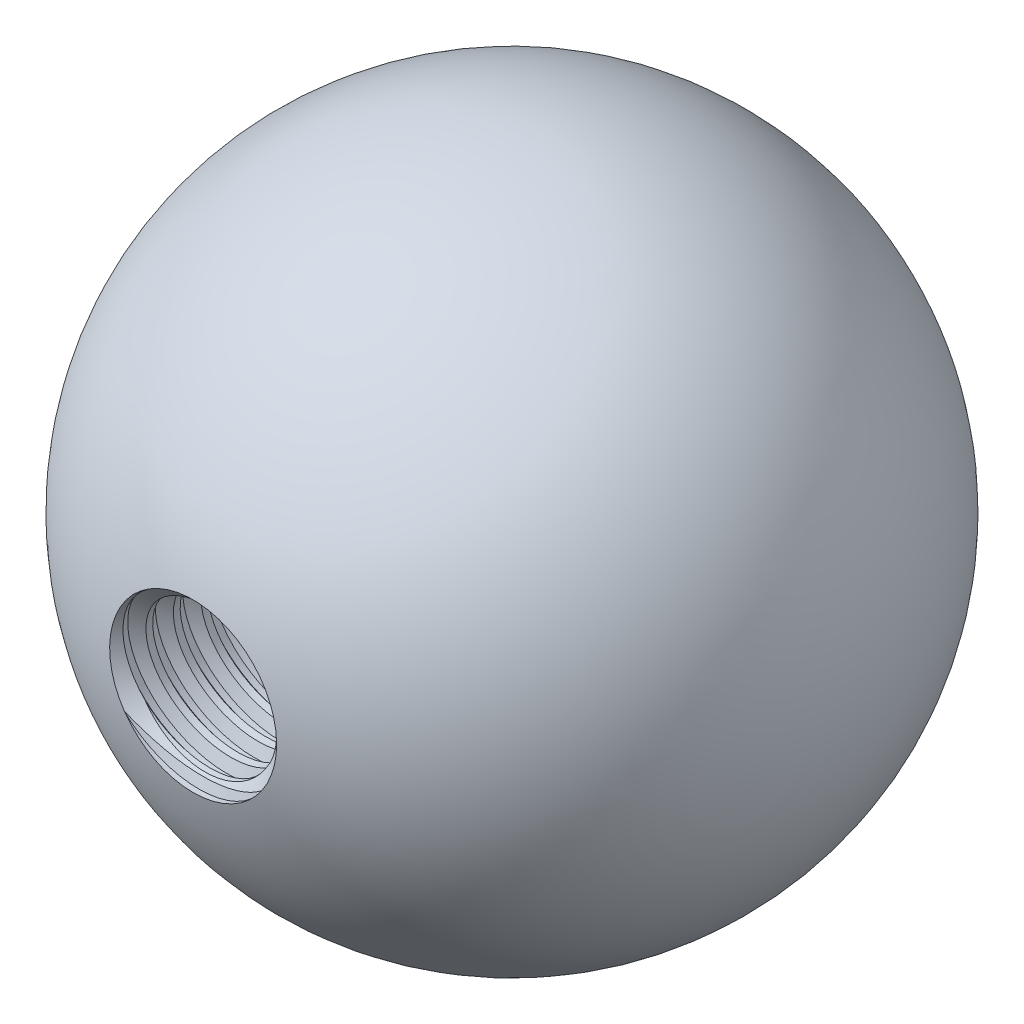
from build123d import *

# Parameters (mm, degrees)
SKETCH1_W           = 9.525
SKETCH1_H           = 2.413
LPATTERN1_COUNT     = 12
LPATTERN1_PITCH     = 0.79375
LPATTERN1_COL_COUNT = 2
LPATTERN1_COL_PITCH = 0.79375


with BuildPart() as part:
    # Sketch1 → Revolve1 (revolve)
    with BuildSketch(Plane(origin=(0, 0, 0), x_dir=(0, 0, -1), z_dir=(1, 0, 0)), mode=Mode.PRIVATE) as revolve1_sk:
        with Locations((0, 1.2065)):
            Rectangle(SKETCH1_W, SKETCH1_H)
    revolve(revolve1_sk.sketch.rotate(Axis((0, 0, 8.5598), (0, 0, -1)), 180), axis=Axis((0, 0, 8.5598), (0, 0, -1)))

    # Sketch2 → Cut-Revolve1 (revolve, cut)
    with BuildSketch(Plane(origin=(0, 0, 0), x_dir=(0, 0, -1), z_dir=(1, 0, 0)), mode=Mode.PRIVATE) as cut_revolve1_sk:
        Polygon((-4.664596635, 2.429102527), (-3.979273076, 2.541820218), (-4.154305502, 2.077629892), (-4.350112233, 2.045424837), align=None)
    cut_revolve1 = revolve(cut_revolve1_sk.sketch.rotate(Axis((0, -0.139697061, 4.7625), (0, 0.16229318767089757, -0.9867425810390564)), 180), axis=Axis((0, -0.139697061, 4.7625), (0, 0.16229318767089757, -0.9867425810390564)), mode=Mode.SUBTRACT)

    # LPattern1: Cut-Revolve1 ×12
    with Locations(*[(0, 0, -i * LPATTERN1_PITCH) for i in range(1, LPATTERN1_COUNT)]):
        add(cut_revolve1, mode=Mode.SUBTRACT)

    # LPattern1 col: Cut-Revolve1 ×2
    with Locations(*[(0, 0, i * LPATTERN1_COL_PITCH) for i in range(1, LPATTERN1_COL_COUNT)]):
        add(cut_revolve1, mode=Mode.SUBTRACT)


with BuildPart() as body_2:
    # Sketch5 → Revolve3 (revolve)
    with BuildSketch(Plane(origin=(0, 0, 0), x_dir=(0, 0, -1), z_dir=(1, 0, 0)), mode=Mode.PRIVATE) as revolve3_sk:
        with BuildLine():
            Line((-4.7625, 2.413), (-4.7625, 0))
            Line((-4.7625, 0), (13.976785431, 0))
            ThreePointArc((13.976785431, 0), (5.668246748, 9.447002004), (-4.7625, 2.413))
        make_face()
    revolve(revolve3_sk.sketch.rotate(Axis((0, 0, -13.976785431), (0, 0, 1)), 124.864258734), axis=Axis((0, 0, -13.976785431), (0, 0, 1)))

    # Combine3: cut part
    add(part.part, mode=Mode.SUBTRACT)

    # Sketch10 → Cut-Revolve2 (revolve, cut)
    with BuildSketch(Plane(origin=(0, 0, 0), x_dir=(0, 0, -1), z_dir=(1, 0, 0)), mode=Mode.PRIVATE) as cut_revolve2_sk:
        Polygon((-4.7625, 2.413), (-4.394924837, 2.045424837), (-4.394924837, 0), (-4.7625, 0), align=None)
    revolve(cut_revolve2_sk.sketch.rotate(Axis((0, 0, -13.976785431), (0, 0, 1)), 124.864258734), axis=Axis((0, 0, -13.976785431), (0, 0, 1)), mode=Mode.SUBTRACT)


solid = body_2.part
